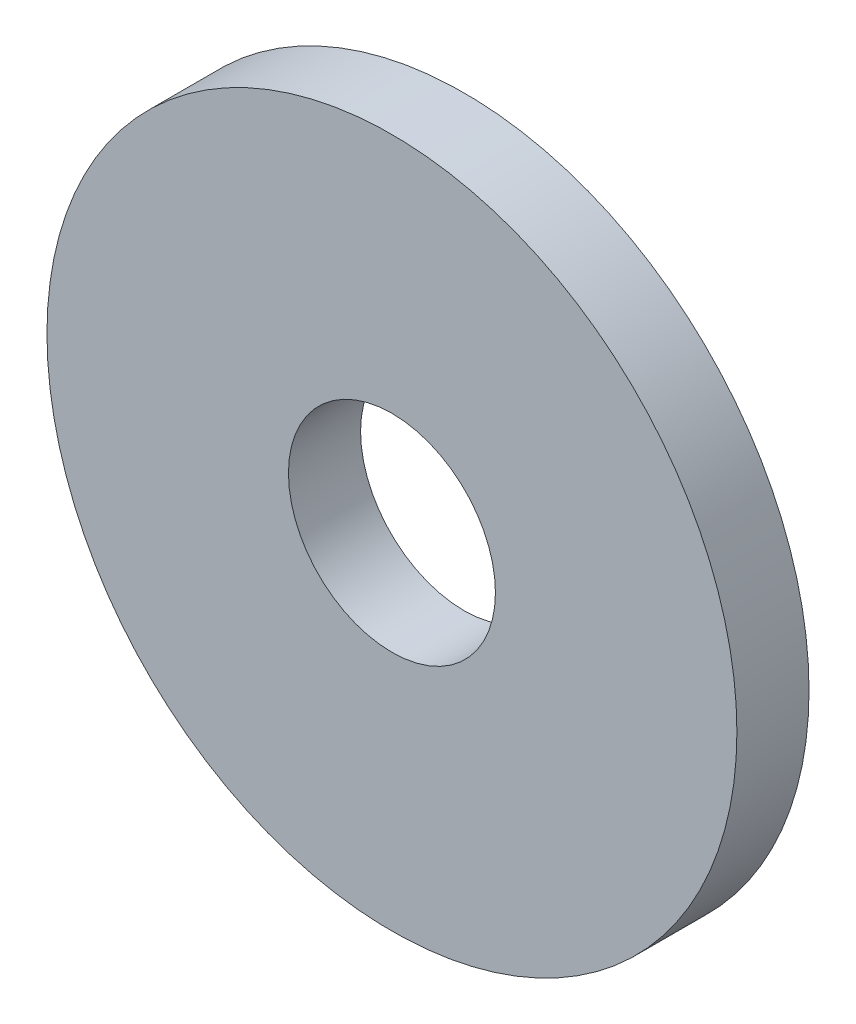
from build123d import *

# Parameters (mm, degrees)
SKETCH1_R           = 11
SKETCH1_R_2         = 3.3
BOSS_EXTRUDE1_DEPTH = 2.3


with BuildPart() as part:
    # Sketch1 → Boss-Extrude1 (new body)
    with BuildSketch(Plane.XY):
        Circle(SKETCH1_R)
        Circle(SKETCH1_R_2, mode=Mode.SUBTRACT)
    extrude(amount=BOSS_EXTRUDE1_DEPTH)


solid = part.part
